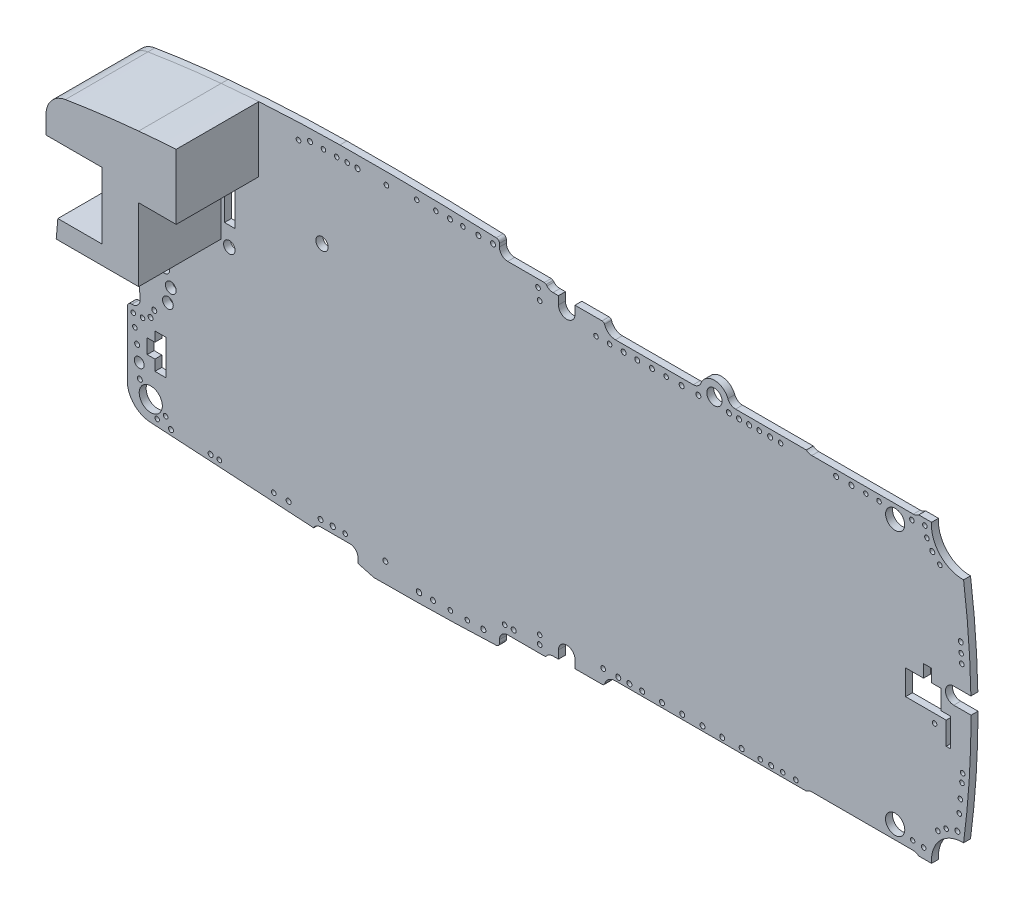
from build123d import *

# Parameters (mm, degrees)
BOARD_OUTLINE_1_DEPTH = 0.84
BOARD_OUTLINE_2_DEPTH = 102.253829684
SKETCH_3_W            = 1.2951
SKETCH_3_H            = 6.0613
BOARD_OUTLINE_3_DEPTH = 102.253829684
BOARD_OUTLINE_4_DEPTH = 102.253829684
SKETCH_5_R            = 0.6005
SKETCH_5_R_2          = 1.4
SKETCH_5_R_3          = 1.0966
SKETCH_5_R_4          = 0.6499
SKETCH_5_R_5          = 0.7
SKETCH_5_R_6          = 0.75
SKETCH_5_R_7          = 0.925
SKETCH_5_R_8          = 1.1674
SKETCH_5_R_9          = 1.156
NPTH_DEPTH            = 102.253829684
SKETCH_6_R            = 0.275
SKETCH_6_R_2          = 0.3021
SKETCH_6_R_3          = 0.2828
SKETCH_6_R_4          = 0.3162
SKETCH_6_R_5          = 0.3148
SKETCH_6_R_6          = 0.3299
SKETCH_6_R_7          = 0.3
SKETCH_6_R_8          = 0.3085
SKETCH_6_R_9          = 0.2881
SKETCH_6_R_10         = 0.2673
SKETCH_6_R_11         = 0.2634
PTH_DEPTH             = 102.253829684
PLACE_KEEPOUT_START   = 0.84
PLACE_KEEPOUT_1_DEPTH = 10


with BuildPart() as part:
    # 草图1 → Board_Outline 1 (new body)
    with BuildSketch(Plane.XY):
        with BuildLine():
            Line((-0.5724, -18.938), (19.2406, -20.1239))
            ThreePointArc((19.2406, -20.1239), (19.608146949, -19.740836442), (20.12, -19.6))
            Line((20.12, -19.6), (23.62, -19.6))
            ThreePointArc((23.62, -19.6), (24.327106781, -19.892893219), (24.62, -20.6))
            Line((24.62, -20.6), (24.62, -21.175))
            Line((24.62, -21.175), (26.5359, -21.6884))
            ThreePointArc((26.5359, -21.6884), (33.953270488, -21.62088149), (41.3672, -21.3851))
            ThreePointArc((41.3672, -21.3851), (41.638919085, -21.262242307), (41.75, -20.9855))
            Line((41.75, -20.9855), (41.75, -20.6))
            ThreePointArc((41.75, -20.6), (42.042893219, -19.892893219), (42.75, -19.6))
            Line((42.75, -19.6), (47.1862, -19.6))
            ThreePointArc((47.1862, -19.6), (47.305405735, -19.575305701), (47.405, -19.5053))
            Line((47.405, -19.5053), (47.513, -19.3901))
            ThreePointArc((47.513, -19.3901), (47.844940127, -19.156634615), (48.2423, -19.0742))
            Line((48.2423, -19.0742), (48.9036, -19.0742))
            Line((48.9036, -19.0742), (48.9034, -18.1002))
            ThreePointArc((48.9034, -18.1002), (49.9032, -17.1), (50.9034, -18.0998))
            Line((50.9034, -18.0998), (50.9036, -19.0742))
            Line((50.9036, -19.0742), (54.2041, -19.0742))
            ThreePointArc((54.2041, -19.0742), (54.38171991, -19.015976939), (54.4904, -18.8639))
            ThreePointArc((54.4904, -18.8639), (54.988458814, -18.166885952), (55.8025, -17.9))
            Line((55.8025, -17.9), (78.9386, -17.9))
            ThreePointArc((78.9386, -17.9), (79.246470946, -17.714603456), (79.6, -17.65))
            Line((79.6, -17.65), (91.9, -17.65))
            ThreePointArc((91.9, -17.65), (92.253529054, -17.714603456), (92.5614, -17.9))
            Line((92.5614, -17.9), (94.1119, -17.9))
            ThreePointArc((94.1119, -17.9), (95.141247368, -14.987486906), (97.9934, -13.8011))
            ThreePointArc((97.9934, -13.8011), (98.673419032, -6.890389506), (98.9, 0.05))
            Line((98.9, 0.05), (96.8, 0.05))
            ThreePointArc((96.8, 0.05), (95.8, 1.05), (96.8, 2.05))
            Line((96.8, 2.05), (98.8801, 2.05))
            ThreePointArc((98.8801, 2.05), (98.600868972, 7.937933887), (97.9934, 13.8011))
            ThreePointArc((97.9934, 13.8011), (95.141247368, 14.987486906), (94.1119, 17.9))
            Line((94.1119, 17.9), (92.5614, 17.9))
            ThreePointArc((92.5614, 17.9), (92.253529054, 17.714603456), (91.9, 17.65))
            Line((91.9, 17.65), (79.6, 17.65))
            ThreePointArc((79.6, 17.65), (79.246470946, 17.714603456), (78.9386, 17.9))
            Line((78.9386, 17.9), (70.3617, 17.9))
            ThreePointArc((70.3617, 17.9), (69.79760277, 18.074248956), (69.4302, 18.5364))
            ThreePointArc((69.4302, 18.5364), (67.8, 19.650532894), (66.1698, 18.5364))
            ThreePointArc((66.1698, 18.5364), (65.80239723, 18.074248956), (65.2383, 17.9))
            Line((65.2383, 17.9), (55.8022, 17.9))
            ThreePointArc((55.8022, 17.9), (54.988059641, 18.167019562), (54.49, 18.8642))
            ThreePointArc((54.49, 18.8642), (54.381286352, 19.016343399), (54.2036, 19.0746))
            ThreePointArc((54.2036, 19.0746), (54.1905, 19.074897281), (54.1774, 19.0746))
            Line((54.1774, 19.0746), (50.9036, 19.0746))
            Line((50.9036, 19.0746), (50.9034, 18.0998))
            ThreePointArc((50.9034, 18.0998), (49.9032, 17.1), (48.9034, 18.1002))
            Line((48.9034, 18.1002), (48.9036, 19.0742))
            Line((48.9036, 19.0742), (48.2423, 19.0742))
            ThreePointArc((48.2423, 19.0742), (47.844940127, 19.156634615), (47.513, 19.3901))
            Line((47.513, 19.3901), (47.405, 19.5053))
            ThreePointArc((47.405, 19.5053), (47.305405735, 19.575305701), (47.1862, 19.6))
            Line((47.1862, 19.6), (42.75, 19.6))
            ThreePointArc((42.75, 19.6), (42.042893219, 19.892893219), (41.75, 20.6))
            Line((41.75, 20.6), (41.75, 20.9798))
            ThreePointArc((41.75, 20.9798), (41.638391842, 21.257088653), (41.3657, 21.3795))
            ThreePointArc((41.3657, 21.3795), (31.895422885, 21.635511648), (22.4217, 21.6518))
            ThreePointArc((22.4217, 21.6518), (15.218024449, 21.430045567), (8.0295, 20.9131))
            ThreePointArc((8.0295, 20.9131), (3.581932652, 20.425260342), (-0.8459, 19.7825))
            ThreePointArc((-0.8459, 19.7825), (-2.528568975, 18.832415451), (-3.1958, 17.0189))
            Line((-3.1958, 17.0189), (-3.1958, 14.7036))
            ThreePointArc((-3.1958, 14.7036), (-3.049353391, 14.350046609), (-2.6958, 14.2036))
            Line((-2.6958, 14.2036), (-1.8, 14.2036))
            ThreePointArc((-1.8, 14.2036), (-1.092893219, 13.910706781), (-0.8, 13.2036))
            Line((-0.8, 13.2036), (-0.8, 7.9919))
            ThreePointArc((-0.8, 7.9919), (-1.076319626, 7.326805412), (-1.742, 7.0519))
            Line((-1.742, 7.0519), (-2.1738, 2.116))
            ThreePointArc((-2.1738, 2.116), (-2.230928199, 1.244781345), (-2.25, 0.3719))
            Line((-2.25, 0.3719), (-2.25, -0.3719))
            ThreePointArc((-2.25, -0.3719), (-2.230928199, -1.244781345), (-2.1738, -2.116))
            Line((-2.1738, -2.116), (-1.7826, -6.5876))
            ThreePointArc((-1.7826, -6.5876), (-2.041510275, -7.350369245), (-2.7788, -7.6748))
            Line((-2.7788, -7.6748), (-2.8459, -7.6748))
            ThreePointArc((-2.8459, -7.6748), (-3.199453391, -7.821246609), (-3.3459, -8.1748))
            Line((-3.3459, -8.1748), (-3.3461, -15.9932))
            ThreePointArc((-3.3461, -15.9932), (-2.543701247, -18.016093217), (-0.5724, -18.938))
        make_face()
    extrude(amount=BOARD_OUTLINE_1_DEPTH)

    # 草图2 → Board_Outline 2 (cut, through all)
    with BuildSketch(Plane.XY):
        Polygon((-0.9394, -12.0264), (0, -12.0264), (0, -13.3215), (1.3401, -13.3215), (1.3401, -9.0735), (0, -9.0735), (0, -10.265), (-0.9394, -10.265), align=None)
    extrude(amount=BOARD_OUTLINE_2_DEPTH, mode=Mode.SUBTRACT)

    # 草图3 → Board_Outline 3 (cut, through all)
    with BuildSketch(Plane.XY):
        with Locations((9.08495, 9.55055)):
            Rectangle(SKETCH_3_W, SKETCH_3_H)
    extrude(amount=BOARD_OUTLINE_3_DEPTH, mode=Mode.SUBTRACT)

    # 草图4 → Board_Outline 4 (cut, through all)
    with BuildSketch(Plane.XY):
        Polygon((90.9633, -1.9761), (95.8848, -1.9761), (95.8848, -4.7218), (96.4028, -4.7218), (96.4028, -1.3027), (95.2631, -1.3027), (95.2631, 1.05), (94.1119, 1.05), (94.1119, 2.5827), (93.1391, 2.5827), (93.1391, 1.05), (90.9633, 1.05), align=None)
    extrude(amount=BOARD_OUTLINE_4_DEPTH, mode=Mode.SUBTRACT)

    # 草图5 → NPTH (cut, through all)
    with BuildSketch(Plane.XY):
        with Locations((-1.9, -13.3375)):
            Circle(SKETCH_5_R)
        with Locations((-0.5, -16.5)):
            Circle(SKETCH_5_R_2)
        with Locations((0.3, 17.5)):
            Circle(SKETCH_5_R_3)
        with Locations((1.15, -1.8)):
            Circle(SKETCH_5_R_4)
        with Locations((1.2, 1.325)):
            Circle(SKETCH_5_R_4)
        with Locations((1.575, -5.325)):
            Circle(SKETCH_5_R_4)
        with Locations((1.925, -3.575)):
            Circle(SKETCH_5_R_4)
        with Locations((2.5, 3.15)):
            Circle(SKETCH_5_R_4)
        with Locations((9.025, 4.225)):
            Circle(SKETCH_5_R_5)
        with Locations((20.25, 10.2)):
            Circle(SKETCH_5_R_6)
        with Locations((67.8, 17.9)):
            Circle(SKETCH_5_R_7)
        with Locations((89.7, -16)):
            Circle(SKETCH_5_R_8)
        with Locations((89.7, 16)):
            Circle(SKETCH_5_R_9)
    extrude(amount=NPTH_DEPTH, mode=Mode.SUBTRACT)

    # 草图6 → PTH (cut, through all)
    with BuildSketch(Plane.XY):
        with Locations((-2.625, -8.475)):
            Circle(SKETCH_6_R)
        with Locations((-2.425, -9.9)):
            Circle(SKETCH_6_R)
        with Locations((-2.15, -11.55)):
            Circle(SKETCH_6_R_2)
        with Locations((-1.825, -15.05)):
            Circle(SKETCH_6_R_2)
        with Locations((-1.5, -8.45)):
            Circle(SKETCH_6_R)
        with Locations((-0.525, -7.925)):
            Circle(SKETCH_6_R_2)
        with Locations((-0.15, 16)):
            Circle(SKETCH_6_R_2)
        with Locations((-0.075, -6.95)):
            Circle(SKETCH_6_R_2)
        with Locations((0.275, -18.175)):
            Circle(SKETCH_6_R)
        with Locations((0.325, 3.425)):
            Circle(SKETCH_6_R)
        with Locations((1.3, -17.375)):
            Circle(SKETCH_6_R)
        with Locations((1.95, -18.45)):
            Circle(SKETCH_6_R_2)
        with Locations((3.05, 19.175)):
            Circle(SKETCH_6_R_2)
        with Locations((4.825, 19.325)):
            Circle(SKETCH_6_R_2)
        with Locations((6.475, 19.4)):
            Circle(SKETCH_6_R_2)
        with Locations((6.75, -18.65)):
            Circle(SKETCH_6_R_2)
        with Locations((7.8, -18.7)):
            Circle(SKETCH_6_R_3)
        with Locations((8.025, 19.475)):
            Circle(SKETCH_6_R)
        with Locations((9.2, 19.6)):
            Circle(SKETCH_6_R_2)
        with Locations((10.825, 19.7)):
            Circle(SKETCH_6_R_2)
        with Locations((14.4, -18.85)):
            Circle(SKETCH_6_R)
        with Locations((16.2, -18.85)):
            Circle(SKETCH_6_R_2)
        with Locations((17.4, 19.65)):
            Circle(SKETCH_6_R_3)
        with Locations((18.8, 20.2)):
            Circle(SKETCH_6_R_2)
        with Locations((20.075, -18.825)):
            Circle(SKETCH_6_R_2)
        with Locations((20.425, 20.2)):
            Circle(SKETCH_6_R)
        with Locations((21.55, -18.8)):
            Circle(SKETCH_6_R_4)
        with Locations((22.025, 20.2)):
            Circle(SKETCH_6_R)
        with Locations((23.05, -18.825)):
            Circle(SKETCH_6_R)
        with Locations((23.3, 20.25)):
            Circle(SKETCH_6_R)
        with Locations((24.55, 20.25)):
            Circle(SKETCH_6_R_5)
        with Locations((27.925, -19.275)):
            Circle(SKETCH_6_R_2)
        with Locations((28.05, 20.25)):
            Circle(SKETCH_6_R_3)
        with Locations((31.725, 20.55)):
            Circle(SKETCH_6_R)
        with Locations((32, -20.5)):
            Circle(SKETCH_6_R_6)
        with Locations((33.7, -20.5)):
            Circle(SKETCH_6_R_2)
        with Locations((34.05, 20.55)):
            Circle(SKETCH_6_R)
        with Locations((35.75, 20.55)):
            Circle(SKETCH_6_R_2)
        with Locations((35.8, -20.5)):
            Circle(SKETCH_6_R)
        with Locations((37.325, 20.55)):
            Circle(SKETCH_6_R)
        with Locations((37.85, -20.5)):
            Circle(SKETCH_6_R)
        with Locations((39.2, 20.55)):
            Circle(SKETCH_6_R_7)
        with Locations((39.8, -20.5)):
            Circle(SKETCH_6_R_8)
        with Locations((40.975, 20.55)):
            Circle(SKETCH_6_R_2)
        with Locations((42.375, -18.725)):
            Circle(SKETCH_6_R)
        with Locations((43.475, -18.725)):
            Circle(SKETCH_6_R_2)
        with Locations((46.425, 18.7)):
            Circle(SKETCH_6_R_3)
        with Locations((46.625, -18.675)):
            Circle(SKETCH_6_R)
        with Locations((46.625, -17.65)):
            Circle(SKETCH_6_R)
        with Locations((46.625, 17.425)):
            Circle(SKETCH_6_R_3)
        with Locations((53.45, 17.1)):
            Circle(SKETCH_6_R)
        with Locations((54.325, -17.35)):
            Circle(SKETCH_6_R_9)
        with Locations((55.1, 17.1)):
            Circle(SKETCH_6_R)
        with Locations((56.15, -17.35)):
            Circle(SKETCH_6_R_2)
        with Locations((56.8, 17.1)):
            Circle(SKETCH_6_R_2)
        with Locations((57.5, -17.35)):
            Circle(SKETCH_6_R_2)
        with Locations((58.45, 17.1)):
            Circle(SKETCH_6_R_2)
        with Locations((59.05, -17.35)):
            Circle(SKETCH_6_R_2)
        with Locations((60.225, 17.1)):
            Circle(SKETCH_6_R_2)
        with Locations((61.45, -17.35)):
            Circle(SKETCH_6_R_2)
        with Locations((61.95, 17.1)):
            Circle(SKETCH_6_R)
        with Locations((63.825, 17.1)):
            Circle(SKETCH_6_R_2)
        with Locations((63.9, -17.35)):
            Circle(SKETCH_6_R_2)
        with Locations((65.85, 17.1)):
            Circle(SKETCH_6_R_2)
        with Locations((66.35, -17.35)):
            Circle(SKETCH_6_R_2)
        with Locations((68.75, -17.35)):
            Circle(SKETCH_6_R_2)
        with Locations((69.55, 17.1)):
            Circle(SKETCH_6_R_2)
        with Locations((70.775, 17.075)):
            Circle(SKETCH_6_R_2)
        with Locations((71.1, -17.35)):
            Circle(SKETCH_6_R_2)
        with Locations((72, 17.075)):
            Circle(SKETCH_6_R_2)
        with Locations((73.225, 17.075)):
            Circle(SKETCH_6_R_3)
        with Locations((73.35, -17.35)):
            Circle(SKETCH_6_R)
        with Locations((74.55, 17.075)):
            Circle(SKETCH_6_R_2)
        with Locations((74.675, -17.35)):
            Circle(SKETCH_6_R_2)
        with Locations((75.825, 17.075)):
            Circle(SKETCH_6_R)
        with Locations((76.075, -17.35)):
            Circle(SKETCH_6_R)
        with Locations((77.675, -17.35)):
            Circle(SKETCH_6_R_3)
        with Locations((82.55, 16.925)):
            Circle(SKETCH_6_R_2)
        with Locations((84.4, 16.925)):
            Circle(SKETCH_6_R_2)
        with Locations((86.15, 16.925)):
            Circle(SKETCH_6_R_10)
        with Locations((87.75, 16.925)):
            Circle(SKETCH_6_R)
        with Locations((91.725, 16.95)):
            Circle(SKETCH_6_R)
        with Locations((91.825, -16.625)):
            Circle(SKETCH_6_R_11)
        with Locations((93.15, -16.7)):
            Circle(SKETCH_6_R)
        with Locations((93.3, 17.15)):
            Circle(SKETCH_6_R)
        with Locations((93.55, 15.975)):
            Circle(SKETCH_6_R)
        with Locations((94.2, 14.875)):
            Circle(SKETCH_6_R_2)
        with Locations((94.475, -3.025)):
            Circle(SKETCH_6_R)
        with Locations((94.875, -14.1)):
            Circle(SKETCH_6_R)
        with Locations((95.125, 13.95)):
            Circle(SKETCH_6_R)
        with Locations((95.875, -13.375)):
            Circle(SKETCH_6_R)
        with Locations((97.25, -12.95)):
            Circle(SKETCH_6_R_2)
        with Locations((97.475, -10.975)):
            Circle(SKETCH_6_R)
        with Locations((97.6, -9.4)):
            Circle(SKETCH_6_R)
        with Locations((97.65, 7.125)):
            Circle(SKETCH_6_R_2)
        with Locations((97.7, 5.95)):
            Circle(SKETCH_6_R)
        with Locations((97.775, 4.875)):
            Circle(SKETCH_6_R)
        with Locations((97.8, -7.6)):
            Circle(SKETCH_6_R)
        with Locations((97.875, -6.55)):
            Circle(SKETCH_6_R)
    extrude(amount=PTH_DEPTH, mode=Mode.SUBTRACT)


with BuildPart() as body_2:
    # 草图7 → Place_Keepout 零部件外置区域 1 (new body)
    with BuildSketch(Plane.XY.offset(PLACE_KEEPOUT_START)):
        with BuildLine():
            Line((-3.1958, 14.8826), (3.5852, 14.8826))
            Line((3.5852, 14.8826), (3.5852, 6.8399))
            Line((3.5852, 6.8399), (-1.7606, 6.8399))
            Line((-1.7606, 6.8399), (-1.9579, 4.584))
            Line((-1.9579, 4.584), (8.0295, 4.584))
            Line((8.0295, 4.584), (8.0295, 13.3916))
            Line((8.0295, 13.3916), (12.5799, 13.3916))
            Line((12.5799, 13.3916), (12.5799, 21.2737))
            ThreePointArc((12.5799, 21.2737), (10.303519922, 21.108291362), (8.0295, 20.9131))
            ThreePointArc((8.0295, 20.9131), (3.581932652, 20.425260342), (-0.8459, 19.7825))
            ThreePointArc((-0.8459, 19.7825), (-2.528568975, 18.832415451), (-3.1958, 17.0189))
            Line((-3.1958, 17.0189), (-3.1958, 14.8826))
        make_face()
    extrude(amount=PLACE_KEEPOUT_1_DEPTH)


solid = Compound([part.part, body_2.part])
